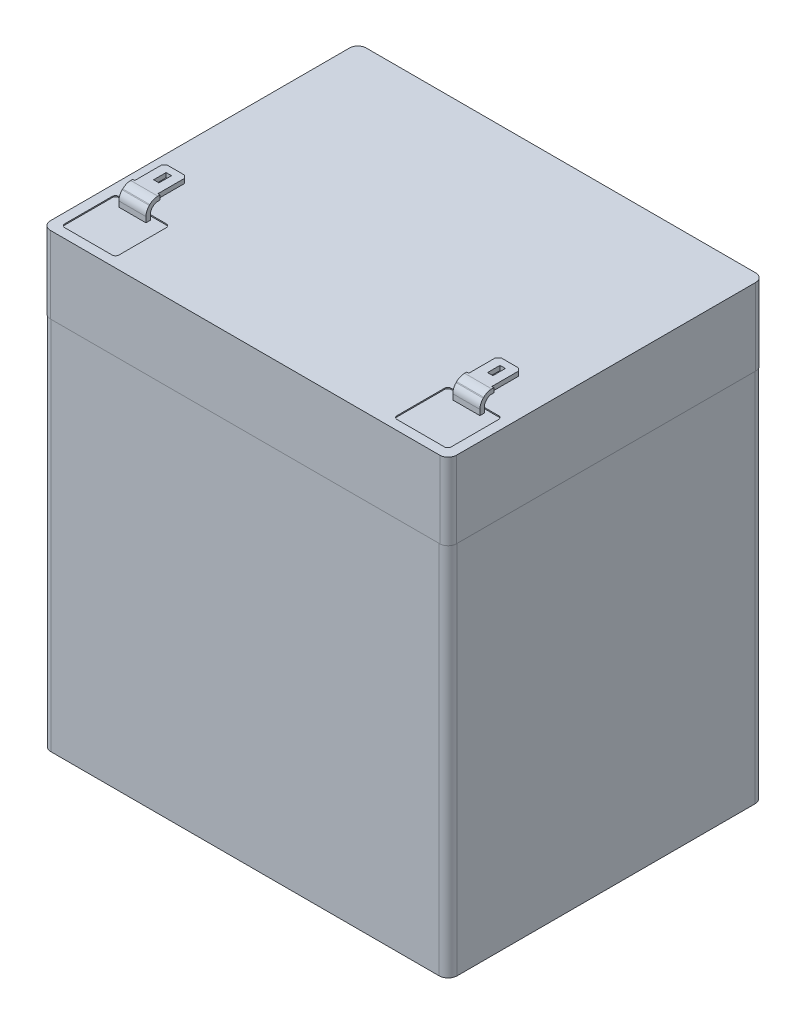
from build123d import *

# Parameters (mm, degrees)
BOSS_EXTRUDE1_DEPTH = 83
BOSS_EXTRUDE2_DEPTH = 17
CUT_EXTRUDE1_DEPTH  = 0.5
BOSS_EXTRUDE3_DEPTH = 0.25
EXTRUDE_THIN1_DEPTH = 3
EXTRUDE_THIN2_DEPTH = 6
SKETCH10_W          = 1.2
SKETCH10_H          = 2.775138775
CUT_EXTRUDE2_DEPTH  = 1


with BuildPart() as part:
    # Sketch1 → Boss-Extrude1 (new body)
    with BuildSketch(Plane(origin=(0, 0, 0), x_dir=(1, 0, 0), z_dir=(0, 1, 0))):
        with BuildLine():
            Line((-43, 35), (43, 35))
            ThreePointArc((43, 35), (44.414213562, 34.414213562), (45, 33))
            Line((45, 33), (45, -33))
            ThreePointArc((45, -33), (44.414213562, -34.414213562), (43, -35))
            Line((43, -35), (-43, -35))
            ThreePointArc((-43, -35), (-44.414213562, -34.414213562), (-45, -33))
            Line((-45, -33), (-45, 33))
            ThreePointArc((-45, 33), (-44.414213562, 34.414213562), (-43, 35))
        make_face()
    extrude(amount=BOSS_EXTRUDE1_DEPTH)


with BuildPart() as body_2:
    # Sketch2 → Boss-Extrude2 (new body)
    with BuildSketch(Plane(origin=(0, 83, 0), x_dir=(1, 0, 0), z_dir=(0, 1, 0))):
        with BuildLine():
            Line((-43.15, 35), (43.15, 35))
            ThreePointArc((43.15, 35), (44.458147545, 34.458147545), (45, 33.15))
            Line((45, 33.15), (45, -33.15))
            ThreePointArc((45, -33.15), (44.458147545, -34.458147545), (43.15, -35))
            Line((43.15, -35), (-43.15, -35))
            ThreePointArc((-43.15, -35), (-44.458147545, -34.458147545), (-45, -33.15))
            Line((-45, -33.15), (-45, 33.15))
            ThreePointArc((-45, 33.15), (-44.458147545, 34.458147545), (-43.15, 35))
        make_face()
    extrude(amount=BOSS_EXTRUDE2_DEPTH)

    # Sketch3 → Cut-Extrude1 (cut)
    with BuildSketch(Plane(origin=(0, 100, 0), x_dir=(1, 0, 0), z_dir=(0, 1, 0))):
        with BuildLine():
            Line((-42.0683073, -20.890429663), (-31.5683073, -20.890429663))
            ThreePointArc((-31.5683073, -20.890429663), (-31.037977214, -21.110099577), (-30.8183073, -21.640429663))
            Line((-30.8183073, -21.640429663), (-30.8183073, -32.140429663))
            ThreePointArc((-30.8183073, -32.140429663), (-31.037977214, -32.670759749), (-31.5683073, -32.890429663))
            Line((-31.5683073, -32.890429663), (-42.0683073, -32.890429663))
            ThreePointArc((-42.0683073, -32.890429663), (-42.598637386, -32.670759749), (-42.8183073, -32.140429663))
            Line((-42.8183073, -32.140429663), (-42.8183073, -21.640429663))
            ThreePointArc((-42.8183073, -21.640429663), (-42.598637386, -21.110099577), (-42.0683073, -20.890429663))
        make_face()
        with BuildLine():
            Line((30.8183073, -21.640429663), (30.8183073, -32.140429663))
            ThreePointArc((30.8183073, -32.140429663), (31.037977214, -32.670759749), (31.5683073, -32.890429663))
            Line((31.5683073, -32.890429663), (42.0683073, -32.890429663))
            ThreePointArc((42.0683073, -32.890429663), (42.598637386, -32.670759749), (42.8183073, -32.140429663))
            Line((42.8183073, -32.140429663), (42.8183073, -21.640429663))
            ThreePointArc((42.8183073, -21.640429663), (42.598637386, -21.110099577), (42.0683073, -20.890429663))
            Line((42.0683073, -20.890429663), (31.5683073, -20.890429663))
            ThreePointArc((31.5683073, -20.890429663), (31.037977214, -21.110099577), (30.8183073, -21.640429663))
        make_face()
    extrude(amount=-CUT_EXTRUDE1_DEPTH, mode=Mode.SUBTRACT)

    # Sketch5 → Boss-Extrude3 (add)
    with BuildSketch(Plane(origin=(0, 99.5, 0), x_dir=(1, 0, 0), z_dir=(0, 1, 0))):
        with BuildLine():
            Line((-42.0683073, -20.890429663), (-31.5683073, -20.890429663))
            ThreePointArc((-31.5683073, -20.890429663), (-31.037977214, -21.110099577), (-30.8183073, -21.640429663))
            Line((-30.8183073, -21.640429663), (-30.8183073, -32.140429663))
            ThreePointArc((-30.8183073, -32.140429663), (-31.037977214, -32.670759749), (-31.5683073, -32.890429663))
            Line((-31.5683073, -32.890429663), (-42.0683073, -32.890429663))
            ThreePointArc((-42.0683073, -32.890429663), (-42.598637386, -32.670759749), (-42.8183073, -32.140429663))
            Line((-42.8183073, -32.140429663), (-42.8183073, -21.640429663))
            ThreePointArc((-42.8183073, -21.640429663), (-42.598637386, -21.110099577), (-42.0683073, -20.890429663))
        make_face()
        with BuildLine():
            Line((30.8183073, -21.640429663), (30.8183073, -32.140429663))
            ThreePointArc((30.8183073, -32.140429663), (31.037977214, -32.670759749), (31.5683073, -32.890429663))
            Line((31.5683073, -32.890429663), (42.0683073, -32.890429663))
            ThreePointArc((42.0683073, -32.890429663), (42.598637386, -32.670759749), (42.8183073, -32.140429663))
            Line((42.8183073, -32.140429663), (42.8183073, -21.640429663))
            ThreePointArc((42.8183073, -21.640429663), (42.598637386, -21.110099577), (42.0683073, -20.890429663))
            Line((42.0683073, -20.890429663), (31.5683073, -20.890429663))
            ThreePointArc((31.5683073, -20.890429663), (31.037977214, -21.110099577), (30.8183073, -21.640429663))
        make_face()
    extrude(amount=BOSS_EXTRUDE3_DEPTH)


with BuildPart() as body_3:
    # Sketch6 → Extrude-Thin1 (new, symmetric)
    with BuildSketch(Plane.ZY.offset(37)):
        with BuildLine():
            Line((21.963554927, 100), (21.963554927, 101.199727134))
            ThreePointArc((21.963554927, 101.199727134), (21.849374226, 101.773752283), (21.524215099, 102.260387306))
            Line((21.524215099, 102.260387306), (21.404257952, 102.380344453))
            ThreePointArc((21.404257952, 102.380344453), (20.917622929, 102.70550358), (20.34359778, 102.819684281))
            Line((20.34359778, 102.819684281), (13.34359778, 102.819684281))
            Line((13.34359778, 102.819684281), (13.34359778, 103.819684281))
            Line((13.34359778, 103.819684281), (20.34359778, 103.819684281))
            ThreePointArc((20.34359778, 103.819684281), (21.300306361, 103.629383113), (22.111364733, 103.087451234))
            Line((22.111364733, 103.087451234), (22.23132188, 102.967494087))
            ThreePointArc((22.23132188, 102.967494087), (22.773253759, 102.156435715), (22.963554927, 101.199727134))
            Line((22.963554927, 101.199727134), (22.963554927, 100))
            Line((22.963554927, 100), (21.963554927, 100))
        make_face()
    extrude(amount=EXTRUDE_THIN1_DEPTH, both=True)


with BuildPart() as body_4:
    # Sketch9 → Extrude-Thin2 (new body)
    with BuildSketch(Plane(origin=(34, 0, 0), x_dir=(0, 0, -1), z_dir=(1, 0, 0))):
        with BuildLine():
            Line((-21.963554927, 100), (-21.963554927, 101.199727134))
            ThreePointArc((-21.963554927, 101.199727134), (-21.849374226, 101.773752283), (-21.524215099, 102.260387306))
            Line((-21.524215099, 102.260387306), (-21.404257952, 102.380344453))
            ThreePointArc((-21.404257952, 102.380344453), (-20.917622929, 102.70550358), (-20.34359778, 102.819684281))
            Line((-20.34359778, 102.819684281), (-13.34359778, 102.819684281))
            Line((-13.34359778, 102.819684281), (-13.34359778, 103.819684281))
            Line((-13.34359778, 103.819684281), (-20.34359778, 103.819684281))
            ThreePointArc((-20.34359778, 103.819684281), (-21.300306361, 103.629383113), (-22.111364733, 103.087451234))
            Line((-22.111364733, 103.087451234), (-22.23132188, 102.967494087))
            ThreePointArc((-22.23132188, 102.967494087), (-22.773253759, 102.156435715), (-22.963554927, 101.199727134))
            Line((-22.963554927, 101.199727134), (-22.963554927, 100))
            Line((-22.963554927, 100), (-21.963554927, 100))
        make_face()
    extrude(amount=EXTRUDE_THIN2_DEPTH)


with BuildPart() as cut_extrude2_tool:
    # Sketch10 → Cut-Extrude2 (new body)
    with BuildSketch(Plane(origin=(0, 103.819684281, 0), x_dir=(1, 0, 0), z_dir=(0, 1, 0))):
        Polygon((-38.926975524, -13.34359778), (-39.549475921, -13.966098177), (-39.549475921, -19.873464752), (-40, -19.873464752), (-40, -13.34359778), align=None)
        Polygon((-34, -13.34359778), (-35.073024476, -13.34359778), (-34.450524079, -13.966098177), (-34.450524079, -19.873464752), (-34, -19.873464752), align=None)
        with Locations((-37, -16.288207362)):
            Rectangle(SKETCH10_W, SKETCH10_H)
        with Locations((37, -16.288207362)):
            Rectangle(SKETCH10_W, SKETCH10_H)
        Polygon((35.073024476, -13.34359778), (34.450524079, -13.966098177), (34.450524079, -19.873464752), (34, -19.873464752), (34, -13.34359778), align=None)
        Polygon((40, -13.34359778), (38.926975524, -13.34359778), (39.549475921, -13.966098177), (39.549475921, -19.873464752), (40, -19.873464752), align=None)
    extrude(amount=-CUT_EXTRUDE2_DEPTH)


with BuildPart() as body_3_1:
    add(body_3.part)

    # Cut-Extrude2: cut by cut_extrude2_tool
    add(cut_extrude2_tool.part, mode=Mode.SUBTRACT)


with BuildPart() as body_4_1:
    add(body_4.part)

    # Cut-Extrude2: cut by cut_extrude2_tool
    add(cut_extrude2_tool.part, mode=Mode.SUBTRACT)


solid = Compound([part.part, body_2.part, body_3_1.part, body_4_1.part])
